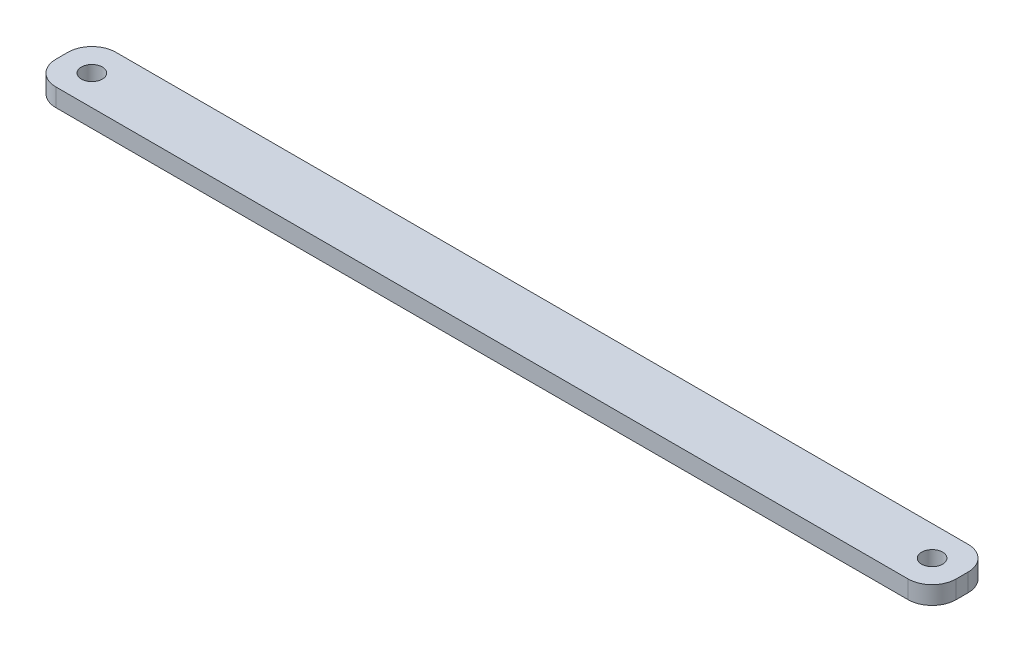
from build123d import *

# Parameters (mm, degrees)
SKETCH1_W           = 150
SKETCH1_H           = 10
BOSS_EXTRUDE1_DEPTH = 3
FILLET1_R           = 4
SKETCH4_R           = 1.75
CUT_EXTRUDE1_DEPTH  = 76.226325179


with BuildPart() as part:
    # Sketch1 → Boss-Extrude1 (new body)
    with BuildSketch(Plane(origin=(0, 0, 0), x_dir=(1, 0, 0), z_dir=(0, 1, 0))):
        Rectangle(SKETCH1_W, SKETCH1_H)
    extrude(amount=BOSS_EXTRUDE1_DEPTH)

    # Fillet1
    fillet1_edges = [part.edges().sort_by_distance(p)[0] for p in [
        (75, 1.5, 5),
        (-75, 1.5, 5),
        (-75, 1.5, -5),
        (75, 1.5, -5),
    ]]
    fillet(fillet1_edges, radius=FILLET1_R)

    # Sketch4 → Cut-Extrude1 (cut, through all)
    with BuildSketch(Plane(origin=(0, 3, 0), x_dir=(1, 0, 0), z_dir=(0, 1, 0))):
        with Locations(Location((-70, 0, 0), (0, 0, 270))):
            Circle(SKETCH4_R)
        with Locations(Location((70, 0, 0), (0, 0, 270))):
            Circle(SKETCH4_R)
    extrude(amount=-CUT_EXTRUDE1_DEPTH, mode=Mode.SUBTRACT)


solid = part.part
